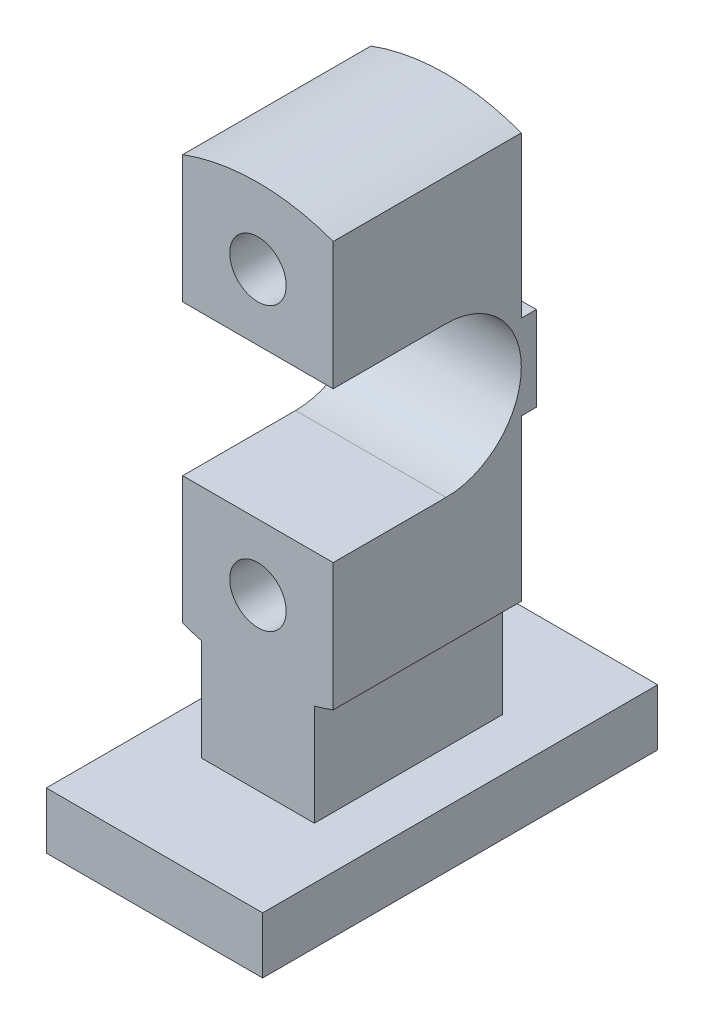
from build123d import *

# Parameters (mm, degrees)
SKETCH1_W           = 115
SKETCH1_H           = 210
BOSS_EXTRUDE1_DEPTH = 30
SKETCH2_W           = 60
SKETCH2_H           = 60
BOSS_EXTRUDE3_DEPTH = 50
SKETCH3_R           = 15
BOSS_EXTRUDE4_DEPTH = 50
SKETCH8_W           = 8
SKETCH8_H           = 45
BOSS_EXTRUDE7_DEPTH = 80
CUT_EXTRUDE1_DEPTH  = 180


with BuildPart() as part:
    # Sketch1 → Boss-Extrude1 (new body)
    with BuildSketch(Plane(origin=(0, 0, 0), x_dir=(1, 0, 0), z_dir=(0, 1, 0))):
        Rectangle(SKETCH1_W, SKETCH1_H)
    extrude(amount=BOSS_EXTRUDE1_DEPTH)

    # Sketch2 → Boss-Extrude3 (add, symmetric)
    with BuildSketch(Plane.XY):
        with Locations((0, 60)):
            Rectangle(SKETCH2_W, SKETCH2_H)
    extrude(amount=BOSS_EXTRUDE3_DEPTH, both=True)

    # Sketch3 → Boss-Extrude4 (add, symmetric)
    with BuildSketch(Plane.XY):
        with BuildLine():
            Line((-40, 87.180706736), (-40, 302.819293264))
            ThreePointArc((-40, 302.819293264), (0, 310), (40, 302.819293264))
            Line((40, 302.819293264), (40, 87.180706736))
            ThreePointArc((40, 87.180706736), (0, 80), (-40, 87.180706736))
        make_face()
        with Locations((0, 270)):
            Circle(SKETCH3_R, mode=Mode.SUBTRACT)
        with Locations((0, 120)):
            Circle(SKETCH3_R, mode=Mode.SUBTRACT)
    extrude(amount=BOSS_EXTRUDE4_DEPTH, both=True)

    # Sketch8 → Boss-Extrude7 (add)
    with BuildSketch(Plane(origin=(40, 0, 0), x_dir=(0, 0, -1), z_dir=(1, 0, 0))):
        with Locations((54, 195)):
            Rectangle(SKETCH8_W, SKETCH8_H)
    extrude(amount=-BOSS_EXTRUDE7_DEPTH)

    # Sketch7 → Cut-Extrude1 (cut)
    with BuildSketch(Plane.ZY.offset(40)):
        with BuildLine():
            Line((-10, 235), (50, 235))
            Line((50, 235), (50, 155))
            Line((50, 155), (-10, 155))
            ThreePointArc((-10, 155), (-50, 195), (-10, 235))
        make_face()
    extrude(amount=-CUT_EXTRUDE1_DEPTH, mode=Mode.SUBTRACT)


solid = part.part
